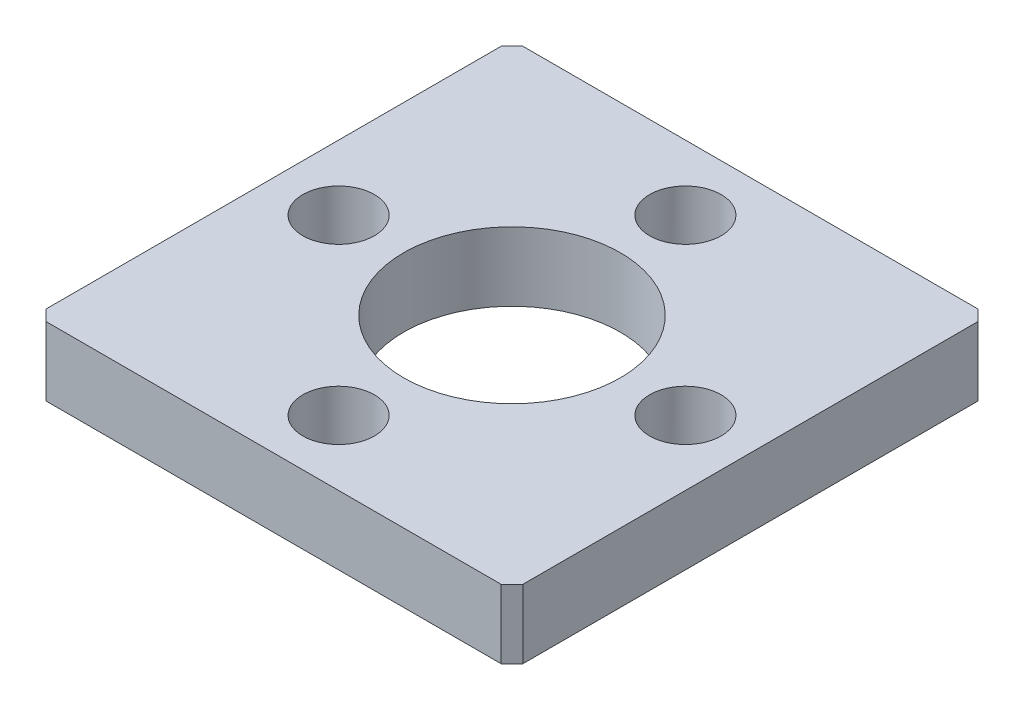
from build123d import *

# Parameters (mm, degrees)
SKETCH1_W                 = 22
SKETCH1_H                 = 22
BOSS_EXTRUDE1_DEPTH       = 3.175
SKETCH2_R                 = 5
CUT_EXTRUDE1_DEPTH        = 16.877047112
CHAMFER1_SIZE             = 0.5
F_3_0MM_DOWEL_HOLE1_D     = 3.3
F_3_0MM_DOWEL_HOLE1_DEPTH = 15
F_3_0MM_DOWEL_HOLE1_TIP   = 0.991420021


with BuildPart() as part:
    # Sketch1 → Boss-Extrude1 (new body)
    with BuildSketch(Plane(origin=(0, 0, 0), x_dir=(1, 0, 0), z_dir=(0, 1, 0))):
        Rectangle(SKETCH1_W, SKETCH1_H)
    extrude(amount=BOSS_EXTRUDE1_DEPTH)

    # Sketch2 → Cut-Extrude1 (cut, through all)
    with BuildSketch(Plane(origin=(0, 3.175, 0), x_dir=(1, 0, 0), z_dir=(0, 1, 0))):
        with Locations(Location((0, 0, 0), (0, 0, 270))):
            Circle(SKETCH2_R)
    extrude(amount=-CUT_EXTRUDE1_DEPTH, mode=Mode.SUBTRACT)

    # Chamfer1
    chamfer1_edges = [part.edges().sort_by_distance(p)[0] for p in [
        (11, 1.5875, 11),
        (-11, 1.5875, 11),
        (-11, 1.5875, -11),
        (11, 1.5875, -11),
    ]]
    chamfer(chamfer1_edges, length=CHAMFER1_SIZE)

    # Ø3.0mm Dowel Hole1
    with Locations(Plane(origin=(0, 3.175, 0), x_dir=(1, 0, 0), z_dir=(0, 1, 0))):
        with Locations((8, 0), (0, -8), (-8, 0), (0, 8)):
            Hole(F_3_0MM_DOWEL_HOLE1_D / 2, depth=F_3_0MM_DOWEL_HOLE1_DEPTH)
            with Locations((0, 0, -(F_3_0MM_DOWEL_HOLE1_DEPTH + F_3_0MM_DOWEL_HOLE1_TIP / 2))):  # 118° drill point
                Cone(0, F_3_0MM_DOWEL_HOLE1_D / 2, F_3_0MM_DOWEL_HOLE1_TIP, mode=Mode.SUBTRACT)


solid = part.part
